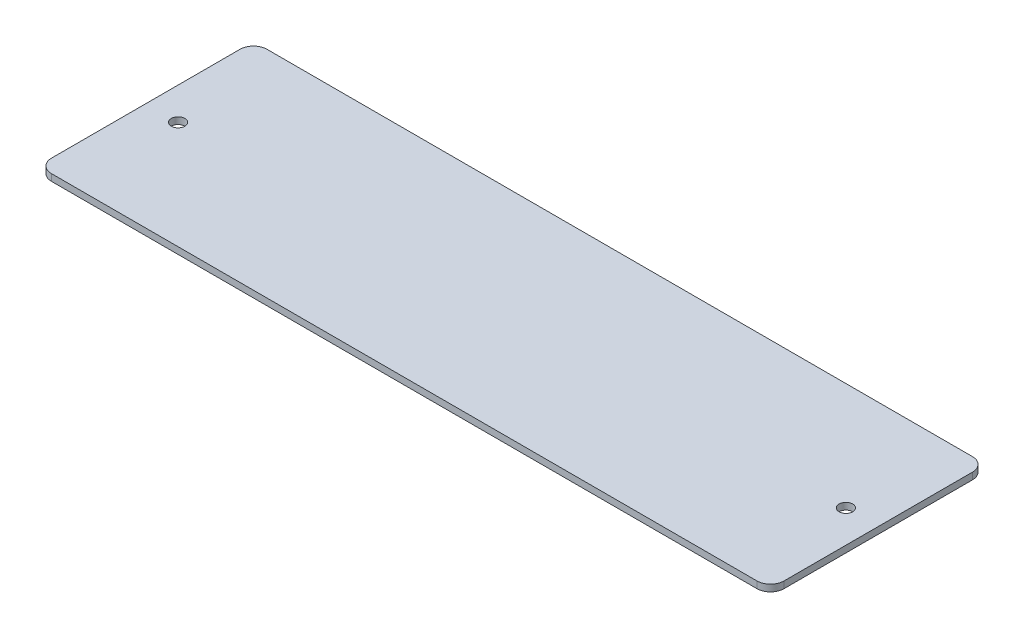
from build123d import *

# Parameters (mm, degrees)
SKETCH1_W           = 172.72
SKETCH1_H           = 50.8
SKETCH1_R           = 1.6002
BOSS_EXTRUDE1_DEPTH = 1.5875
FILLET1_R           = 3.175


with BuildPart() as part:
    # Sketch1 → Boss-Extrude1 (new body)
    with BuildSketch(Plane(origin=(0, 0, 0), x_dir=(1, 0, 0), z_dir=(0, 1, 0))):
        Rectangle(SKETCH1_W, SKETCH1_H)
        with Locations(Location((-78.74, 0, 0), (0, 0, 270))):
            Circle(SKETCH1_R, mode=Mode.SUBTRACT)
        with Locations(Location((78.74, 0, 0), (0, 0, 270))):
            Circle(SKETCH1_R, mode=Mode.SUBTRACT)
    extrude(amount=BOSS_EXTRUDE1_DEPTH)

    # Fillet1
    fillet1_edges = [part.edges().sort_by_distance(p)[0] for p in [
        (86.36, 0.79375, 25.4),
        (-86.36, 0.79375, 25.4),
        (-86.36, 0.79375, -25.4),
        (86.36, 0.79375, -25.4),
    ]]
    fillet(fillet1_edges, radius=FILLET1_R)


solid = part.part
